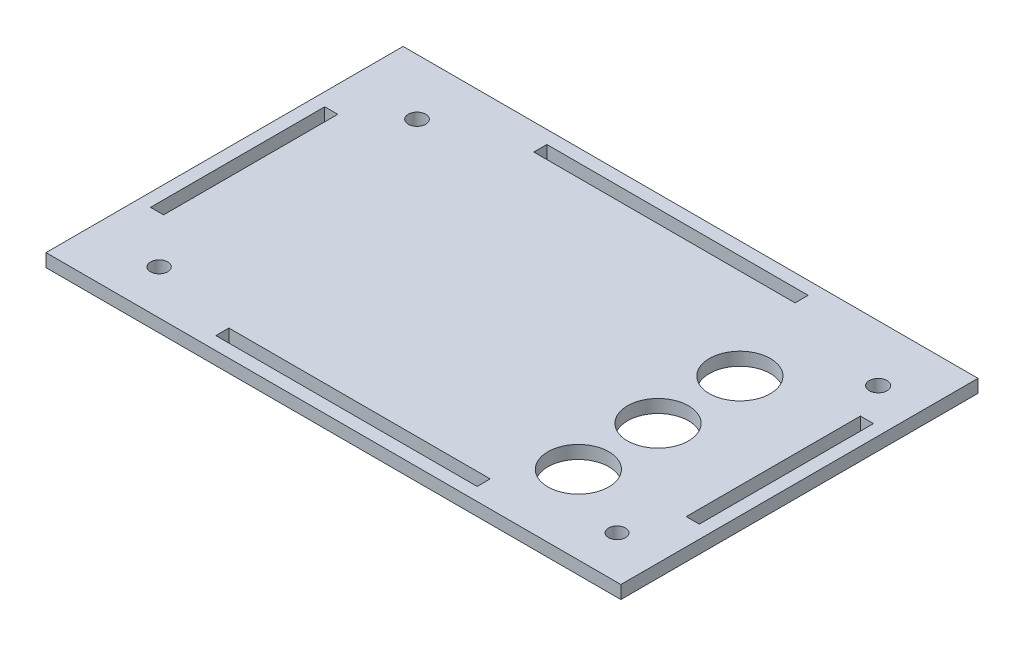
from build123d import *

# Parameters (mm, degrees)
SKETCH2_W           = 132
SKETCH2_H           = 82
SKETCH2_R           = 2.0066
SKETCH2_R_2         = 1.973275495
SKETCH2_R_3         = 2.037679125
SKETCH2_R_4         = 1.940146634
SKETCH2_R_5         = 7
SKETCH2_W_2         = 3
SKETCH2_H_2         = 40
SKETCH2_W_3         = 60
SKETCH2_H_3         = 3
BOSS_EXTRUDE1_DEPTH = 3


with BuildPart() as part:
    # Sketch2 → Boss-Extrude1 (new body)
    with BuildSketch(Plane(origin=(0, 0, 0), x_dir=(1, 0, 0), z_dir=(0, 1, 0))):
        with Locations((-60, 35)):
            Rectangle(SKETCH2_W, SKETCH2_H)
        with Locations(Location((-109.92679739, 63.113788195, 0), (0, 0, 270))):
            Circle(SKETCH2_R, mode=Mode.SUBTRACT)
        with Locations(Location((-110.18079739, 4.154783893, 0), (0, 0, 270))):
            Circle(SKETCH2_R_2, mode=Mode.SUBTRACT)
        with Locations(Location((-4.004277447, 63.080540095, 0), (0, 0, 270))):
            Circle(SKETCH2_R_3, mode=Mode.SUBTRACT)
        with Locations(Location((-4.720233043, 3.837756232, 0), (0, 0, 270))):
            Circle(SKETCH2_R_4, mode=Mode.SUBTRACT)
        with Locations(Location((-21.78879739, 49.11107203, 0), (0, 0, 270))):
            Circle(SKETCH2_R_5, mode=Mode.SUBTRACT)
        with Locations(Location((-21.78879739, 30.315787724, 0), (0, 0, 270))):
            Circle(SKETCH2_R_5, mode=Mode.SUBTRACT)
        with Locations(Location((-21.78879739, 12.028484075, 0), (0, 0, 270))):
            Circle(SKETCH2_R_5, mode=Mode.SUBTRACT)
        with Locations((1.5, 35)):
            Rectangle(SKETCH2_W_2, SKETCH2_H_2, mode=Mode.SUBTRACT)
        with Locations((-121.5, 35)):
            Rectangle(SKETCH2_W_2, SKETCH2_H_2, mode=Mode.SUBTRACT)
        with Locations((-60, 71.5)):
            Rectangle(SKETCH2_W_3, SKETCH2_H_3, mode=Mode.SUBTRACT)
        with Locations((-60, -1.5)):
            Rectangle(SKETCH2_W_3, SKETCH2_H_3, mode=Mode.SUBTRACT)
    extrude(amount=BOSS_EXTRUDE1_DEPTH)


solid = part.part
